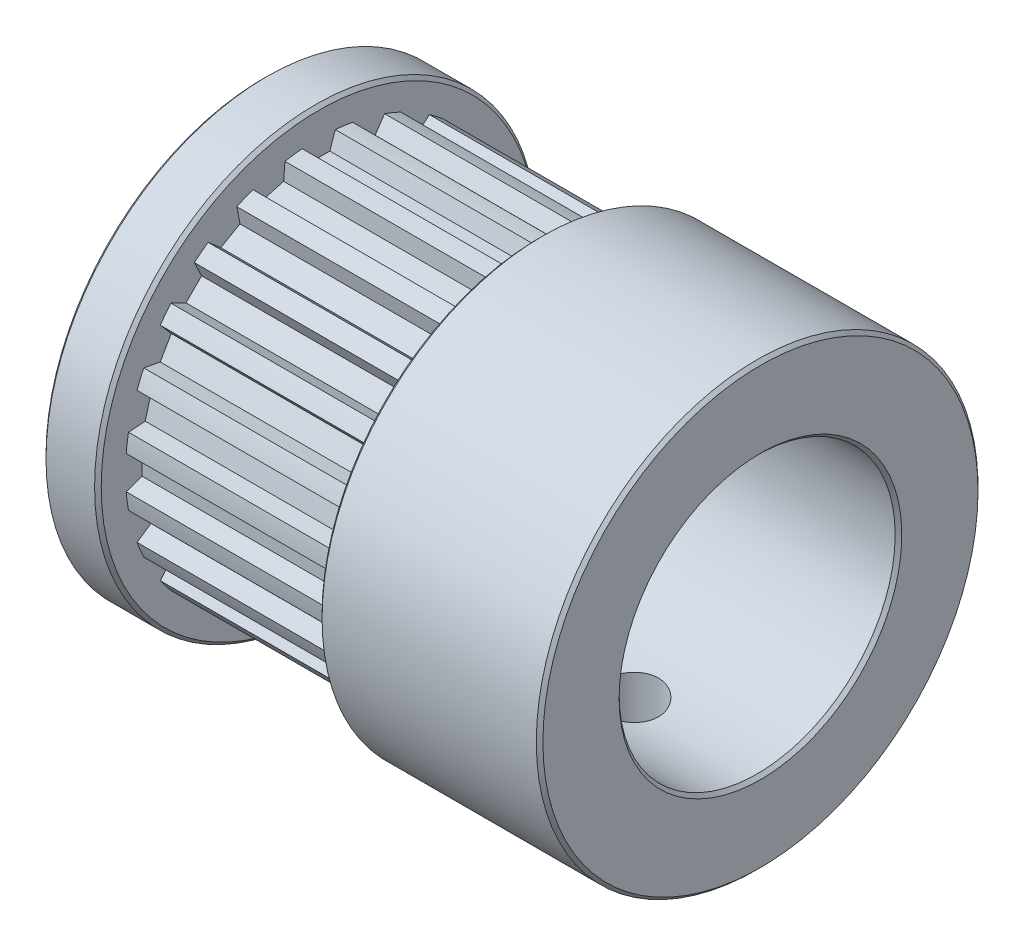
from build123d import *

# Parameters (mm, degrees)
SKETCH_2_R               = 2.75
CUT_EXTRUDE_1_DEPTH      = 54.150729064
CUT_EXTRUDE_START        = 20
CUT_EXTRUDE_2_DEPTH      = 20
PATTERN_CIRCULAR_1_COUNT = 24
CHAMFER_1_SIZE           = 0.3


with BuildPart() as part:
    # Эскиз1 → Повернуть1 (revolve)
    with BuildSketch(Plane.XY, mode=Mode.PRIVATE) as revolve_1_sk:
        Polygon((0, 12.5), (0, 20), (-20, 20), (-20, 17.5), (-40, 17.5), (-40, 20), (-45, 20), (-45, 12.5), align=None)
    revolve(revolve_1_sk.sketch.rotate(Axis((-33.310992453, 0, 0), (1, 0, 0)), 90), axis=Axis((-33.310992453, 0, 0), (1, 0, 0)))

    # Эскиз2 → Вырез-Вытянуть1 (cut, through all)
    with BuildSketch(Plane(origin=(0, 0, 0), x_dir=(1, 0, 0), z_dir=(0, 1, 0))):
        with Locations(Location((-12, 0, 0), (0, 0, 270))):
            Circle(SKETCH_2_R)
    extrude(amount=-CUT_EXTRUDE_1_DEPTH, mode=Mode.SUBTRACT)

    # Эскиз3 → Вырез-Вытянуть2 (cut)
    with BuildSketch(Plane.ZY.offset(20).offset(CUT_EXTRUDE_START)):
        with BuildLine():
            Line((-1.5, 17.435595774), (-1, 16))
            Line((-1, 16), (1, 16))
            Line((1, 16), (1.5, 17.435595774))
            ThreePointArc((1.5, 17.435595774), (0, 17.5), (-1.5, 17.435595774))
        make_face()
    cut_extrude_2 = extrude(amount=-CUT_EXTRUDE_2_DEPTH, mode=Mode.SUBTRACT)

    # Круговой массив1: Вырез-Вытянуть2 ×24 about axis
    pattern_circular_1_axis = Axis((0, 0, 0), (1, 0, 0))
    for i in range(1, PATTERN_CIRCULAR_1_COUNT):
        add(cut_extrude_2.rotate(pattern_circular_1_axis, i * 360 / PATTERN_CIRCULAR_1_COUNT), mode=Mode.SUBTRACT)

    # Фаска1
    chamfer_1_edges = [part.edges().sort_by_distance(p)[0] for p in [
        (0, 0, -12.5),
        (-45, 0, -12.5),
        (-45, 0, -20),
        (-40, 0, -20),
        (-20, 0, -20),
        (0, 0, -20),
    ]]
    chamfer(chamfer_1_edges, length=CHAMFER_1_SIZE)


solid = part.part
